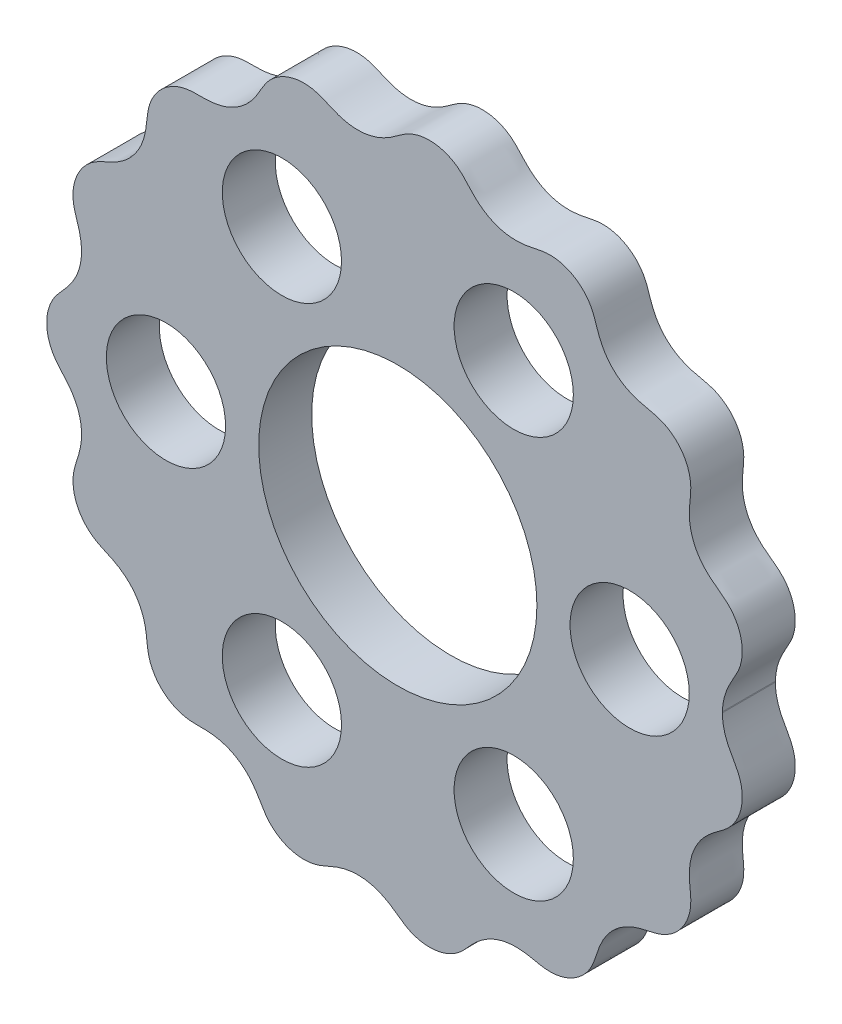
from build123d import *

# Parameters (mm, degrees)
SKETCH1_R           = 10.5
SKETCH1_R_2         = 4.5
BOSS_EXTRUDE1_DEPTH = 4


with BuildPart() as part:
    # Sketch1 → Boss-Extrude1 (new body)
    with BuildSketch(Plane.XY):
        with BuildLine():
            add(Edge.make_bspline(
                [(24.5, 0), (24.5, -0.024846987), (24.500530338, -0.075194401), (24.50291679, -0.173786515), (24.509274948, -0.29214513), (24.521177418, -0.434411522), (24.54175831, -0.608576755), (24.574837679, -0.808942457), (24.624819774, -1.036226563), (24.686539525, -1.260308661), (24.759553431, -1.48115363), (24.848707865, -1.712813104), (24.955678708, -1.954193667), (25.080756319, -2.20436619), (25.223638262, -2.462923732), (25.408424272, -2.782456402), (25.6281432, -3.167261904), (25.855398242, -3.684420043), (26.006987174, -4.354298717), (26.019933256, -5.102352687), (25.856933668, -5.895646173), (25.536080158, -6.597988726), (25.093596332, -7.183522075), (24.582567853, -7.629737789), (24.070173725, -7.983710188), (23.513324133, -8.412842238), (22.958230209, -8.967716254), (22.474264984, -9.678081163), (22.130226177, -10.543239152), (21.993907003, -11.370138923), (21.998118659, -12.113045475), (22.068358348, -12.766377731), (22.129662544, -13.33732376), (22.111032869, -13.962010711), (21.96554356, -14.620809556), (21.670147849, -15.284014121), (21.211345442, -15.910265551), (20.665047379, -16.393562255), (20.073865224, -16.732437681), (19.477045246, -16.937377429), (18.908803357, -17.052890239), (18.260308622, -17.19315449), (17.548230022, -17.429553634), (16.8072659, -17.828173244), (16.100796107, -18.435113156), (15.588812897, -19.119996972), (15.243660204, -19.818021591), (14.966518539, -20.620817614), (14.734533771, -21.415128569), (14.256708506, -22.169615597), (13.56863508, -22.790505876), (12.852229142, -23.188851288), (12.116331984, -23.402559543), (11.401606548, -23.45307254), (10.738196691, -23.364967856), (10.132209544, -23.220501907), (9.457529462, -23.10142469), (8.710113662, -23.065367811), (7.891459976, -23.170904732), (7.041217877, -23.468571472), (6.333464053, -23.901799253), (5.767333358, -24.402275639), (5.317363461, -24.897826901), (4.929764189, -25.336555696), (4.306611073, -25.878766754), (3.513042387, -26.262689198), (2.600566015, -26.427874936), (1.690080739, -26.335232493), (1.048096736, -26.134513287), (0.498255931, -25.841611842), (0.035068054, -25.505096621), (-0.493315559, -25.117912551), (-1.131217323, -24.741588228), (-1.896278453, -24.449018457), (-2.780113174, -24.310066716), (-3.609783394, -24.35350812), (-4.353632868, -24.531106969), (-5.013600198, -24.787011375), (-5.600992225, -25.067967975), (-6.262008402, -25.311178952), (-7.014479991, -25.415201127), (-7.799396849, -25.346863203), (-8.579241596, -25.091080416), (-9.349169254, -24.630805538), (-10.045226058, -23.921126094), (-10.485007412, -23.000301434), (-11.085191287, -22.130652544), (-11.805222942, -21.46193302), (-12.580264419, -21.003894567), (-13.360210466, -20.739326696), (-14.09478796, -20.626924641), (-14.775300264, -20.606965587), (-15.394017356, -20.621727567), (-16.056893496, -20.564184984), (-16.739113489, -20.362564906), (-17.41073524, -19.997042715), (-18.024940221, -19.455766311), (-18.476414838, -18.825496525), (-18.763784027, -18.152422462), (-18.89707884, -17.48915369), (-18.947779876, -16.870109764), (-19.038911063, -16.175109526), (-19.238259856, -15.418290771), (-19.606986858, -14.643174238), (-20.18020372, -13.90953429), (-20.826401419, -13.374072362), (-21.472386849, -13.002680154), (-22.074822584, -12.734998799), (-22.601829588, -12.502970307), (-23.301686752, -12.075072879), (-23.906752826, -11.436109641), (-24.341829491, -10.613608191), (-24.528532128, -9.710690225), (-24.528598524, -9.031300515), (-24.410724594, -8.41342201), (-24.228211519, -7.864831664), (-24.024855797, -7.235458394), (-23.871203676, -6.503384831), (-23.841697229, -5.663639091), (-24.009160199, -4.747423307), (-24.34265786, -3.958692032), (-24.773369642, -3.30728546), (-25.329808123, -2.66235459), (-25.905150217, -2.064473818), (-26.324158361, -1.272952099), (-26.520523124, -0.365506271), (-26.509455078, 0.45404159), (-26.328870168, 1.197744088), (-26.01849623, 1.841098807), (-25.613746564, 2.37174893), (-25.187070334, 2.82322433), (-24.746508684, 3.345198323), (-24.340244741, 3.970913665), (-24.018825831, 4.729990071), (-23.84667446, 5.614357291), (-23.863830991, 6.44526868), (-24.011854338, 7.188638942), (-24.215331554, 7.82845133), (-24.403018606, 8.384707832), (-24.564787805, 9.197163335), (-24.503266335, 10.078197816), (-24.192237051, 10.952234106), (-23.66672377, 11.685062977), (-23.196274064, 12.125383946), (-22.70874682, 12.443053561), (-22.239297157, 12.665735651), (-21.766557231, 12.868650017), (-21.308760084, 13.096211328), (-20.769188781, 13.427367552), (-20.218272947, 13.883982848), (-19.703632958, 14.499866249), (-19.309814552, 15.248452307), (-19.105865443, 15.89435674), (-19.005598257, 16.435287333), (-18.943324824, 16.941460148), (-18.90517994, 17.364382656), (-18.841295446, 17.785504765), (-18.692824294, 18.315201575), (-18.452172268, 18.85594961), (-17.935621591, 19.588431318), (-17.173092267, 20.183443105), (-16.33586778, 20.521067472), (-15.51272142, 20.617732928), (-14.925400468, 20.610950829), (-14.253679169, 20.61538697), (-13.50060545, 20.70486562), (-12.705057201, 20.946072875), (-11.917554416, 21.383839213), (-11.295577567, 21.924530847), (-10.82668108, 22.504301224), (-10.466859064, 23.084463536), (-10.169430942, 23.629464168), (-9.789627277, 24.17784829), (-9.273647183, 24.671254856), (-8.622103567, 25.07241601), (-7.845982087, 25.335837753), (-6.921942529, 25.429116084), (-6.0393649, 25.274486775), (-5.292798764, 24.911490687), (-4.506913935, 24.581814076), (-3.75378545, 24.37386786), (-2.900320227, 24.301181291), (-1.97731353, 24.425898628), (-1.188220181, 24.714086919), (-0.540044783, 25.086668311), (-0.004731574, 25.474531257), (0.460484062, 25.8172881), (1.01162377, 26.119772117), (1.657557492, 26.329149371), (2.573943654, 26.430147948), (3.490641352, 26.270092065), (4.28535213, 25.891520095), (4.908519935, 25.357415925), (5.2920863, 24.927532255), (5.733223868, 24.437178396), (6.286675538, 23.937674282), (6.996174911, 23.489083542), (7.871335177, 23.171452538), (8.722349523, 23.061080561), (9.503309752, 23.105879462), (10.192048906, 23.234219902), (10.796200073, 23.377137608), (11.46793397, 23.454811406), (12.196459873, 23.389089793), (12.935104133, 23.154170474), (13.639506186, 22.736986911), (14.194559804, 22.210786804), (14.596985619, 21.623707865), (14.856246644, 21.010560693), (15.033422041, 20.417253168), (15.263113413, 19.775966089), (15.597652072, 19.111993017), (16.090987247, 18.452232837), (16.766647759, 17.857377165), (17.625291331, 17.380034625), (18.637490698, 17.078940455), (19.648593587, 16.944922211), (20.537863374, 16.501745724), (21.213065808, 15.91164787), (21.697026504, 15.248748561), (22.004297527, 14.52306792), (22.137494029, 13.774804862), (22.10995316, 13.070689013), (22.024229213, 12.424913397), (21.985137591, 11.717797118), (22.046674745, 10.95514065), (22.262518604, 10.152664038), (22.668521855, 9.355415963), (23.183626392, 8.718816769), (23.738647044, 8.229036886), (24.270036545, 7.846527019), (24.732743487, 7.50996843), (25.180806286, 7.077476549), (25.569337788, 6.528973775), (25.860826706, 5.868272332), (26.016563531, 5.113273998), (26.010065193, 4.387102507), (25.882284937, 3.793914557), (25.705334141, 3.341682725), (25.539938197, 3.014979702), (25.395863813, 2.760023407), (25.248685575, 2.506951407), (25.123789171, 2.283217044), (25.02261731, 2.088270966), (24.934243474, 1.904419233), (24.857789901, 1.732222285), (24.780242563, 1.537749472), (24.705093047, 1.319886412), (24.640831683, 1.098732002), (24.58798279, 0.874319575), (24.552108419, 0.67629238), (24.528928594, 0.504119113), (24.51479811, 0.363411721), (24.506510274, 0.245981251), (24.502467935, 0.148591581), (24.501076472, 0.098709425), (24.500646742, 0.074094256)],
                knots=[0.07232348, 0.07232348, 0.07232348, 0.07232348, 0.07232348, 0.072893711, 0.073463942, 0.074034173, 0.074604404, 0.075744866, 0.076885328, 0.07802579, 0.079166252, 0.080306714, 0.081447176, 0.082896333, 0.08434549, 0.085794647, 0.087243803, 0.090142117, 0.093040431, 0.096834448, 0.100628465, 0.104714986, 0.108801507, 0.11185793, 0.114914353, 0.117970775, 0.121027198, 0.125640065, 0.130252932, 0.134704405, 0.139155879, 0.141971283, 0.144786688, 0.147602092, 0.150417497, 0.154180253, 0.157943008, 0.161741643, 0.165540277, 0.16838386, 0.171227444, 0.174071028, 0.176914611, 0.181406401, 0.185898191, 0.190469349, 0.195040508, 0.198069937, 0.201099366, 0.207158225, 0.211207877, 0.21525753, 0.219171376, 0.223085221, 0.226142443, 0.229199665, 0.232256887, 0.235314109, 0.239571369, 0.243828629, 0.248346179, 0.252863729, 0.255735622, 0.258607515, 0.261479408, 0.264351301, 0.271867582, 0.275619031, 0.27937048, 0.28217708, 0.284983681, 0.287790281, 0.290596882, 0.295035626, 0.29947437, 0.303751998, 0.308029627, 0.311225632, 0.314421636, 0.317617641, 0.320813645, 0.324997916, 0.329182187, 0.332964912, 0.336747638, 0.342527545, 0.348307452, 0.352855377, 0.357403302, 0.36163333, 0.365863357, 0.368901143, 0.371938929, 0.374976716, 0.378014502, 0.381903363, 0.385792224, 0.389867163, 0.393942101, 0.396990008, 0.400037916, 0.403085824, 0.406133732, 0.410733496, 0.41533326, 0.419797451, 0.424261641, 0.427085889, 0.429910137, 0.432734385, 0.435558634, 0.443106764, 0.446894094, 0.450681424, 0.453516092, 0.456350759, 0.459185427, 0.462020095, 0.466499189, 0.470978284, 0.475562628, 0.480146973, 0.4831849, 0.486222827, 0.492298681, 0.496359988, 0.500421295, 0.504323657, 0.50822602, 0.511274448, 0.514322876, 0.517371304, 0.520419732, 0.524664158, 0.528908583, 0.533440131, 0.537971678, 0.540851863, 0.543732048, 0.546612233, 0.549492417, 0.557031339, 0.560771485, 0.564511631, 0.567057315, 0.569602999, 0.572148682, 0.574694366, 0.577159525, 0.579624683, 0.584555, 0.588670119, 0.592785238, 0.596120614, 0.597788302, 0.599455991, 0.602791367, 0.604459055, 0.606126744, 0.610236315, 0.614345887, 0.621888724, 0.624770348, 0.627651971, 0.630533594, 0.633415218, 0.637949185, 0.642483152, 0.646725453, 0.650967754, 0.654014611, 0.657061469, 0.660108327, 0.663155184, 0.667055557, 0.670955929, 0.67501925, 0.679082571, 0.685161369, 0.688200768, 0.691240167, 0.69582679, 0.700413412, 0.704890309, 0.709367206, 0.712200333, 0.71503346, 0.717866588, 0.720699715, 0.724485089, 0.728270462, 0.735822507, 0.738648289, 0.741474072, 0.744299854, 0.747125637, 0.751592027, 0.756058418, 0.76065591, 0.765253403, 0.768299837, 0.771346271, 0.774392706, 0.77743914, 0.78151207, 0.785585, 0.789475855, 0.793366711, 0.796406067, 0.799445423, 0.802484779, 0.805524134, 0.809756286, 0.813988438, 0.81853395, 0.823079461, 0.82885648, 0.8346335, 0.838414269, 0.842195038, 0.846381348, 0.850567658, 0.853765193, 0.856962729, 0.860160264, 0.863357799, 0.867637528, 0.871917256, 0.876353796, 0.880790335, 0.883595416, 0.886400497, 0.889205578, 0.892010659, 0.895760151, 0.899509643, 0.903269744, 0.907029844, 0.90990317, 0.911339833, 0.912776496, 0.914213158, 0.915649821, 0.917086484, 0.917804816, 0.918523147, 0.919653141, 0.920783135, 0.921913128, 0.923043122, 0.924173116, 0.92530311, 0.925868107, 0.926433104, 0.9269981, 0.927563097, 0.927563097, 0.927563097, 0.927563097, 0.927563097], degree=4))
            Line((24.500646742, 0.074094256), (24.5, 0))
        make_face()
        Circle(SKETCH1_R, mode=Mode.SUBTRACT)
        with Locations((17.5, 0)):
            Circle(SKETCH1_R_2, mode=Mode.SUBTRACT)
        with Locations((8.75, -15.155444566)):
            Circle(SKETCH1_R_2, mode=Mode.SUBTRACT)
        with Locations((-8.75, -15.155444566)):
            Circle(SKETCH1_R_2, mode=Mode.SUBTRACT)
        with Locations((-17.5, 0)):
            Circle(SKETCH1_R_2, mode=Mode.SUBTRACT)
        with Locations((-8.75, 15.155444566)):
            Circle(SKETCH1_R_2, mode=Mode.SUBTRACT)
        with Locations((8.75, 15.155444566)):
            Circle(SKETCH1_R_2, mode=Mode.SUBTRACT)
    extrude(amount=BOSS_EXTRUDE1_DEPTH)


solid = part.part
